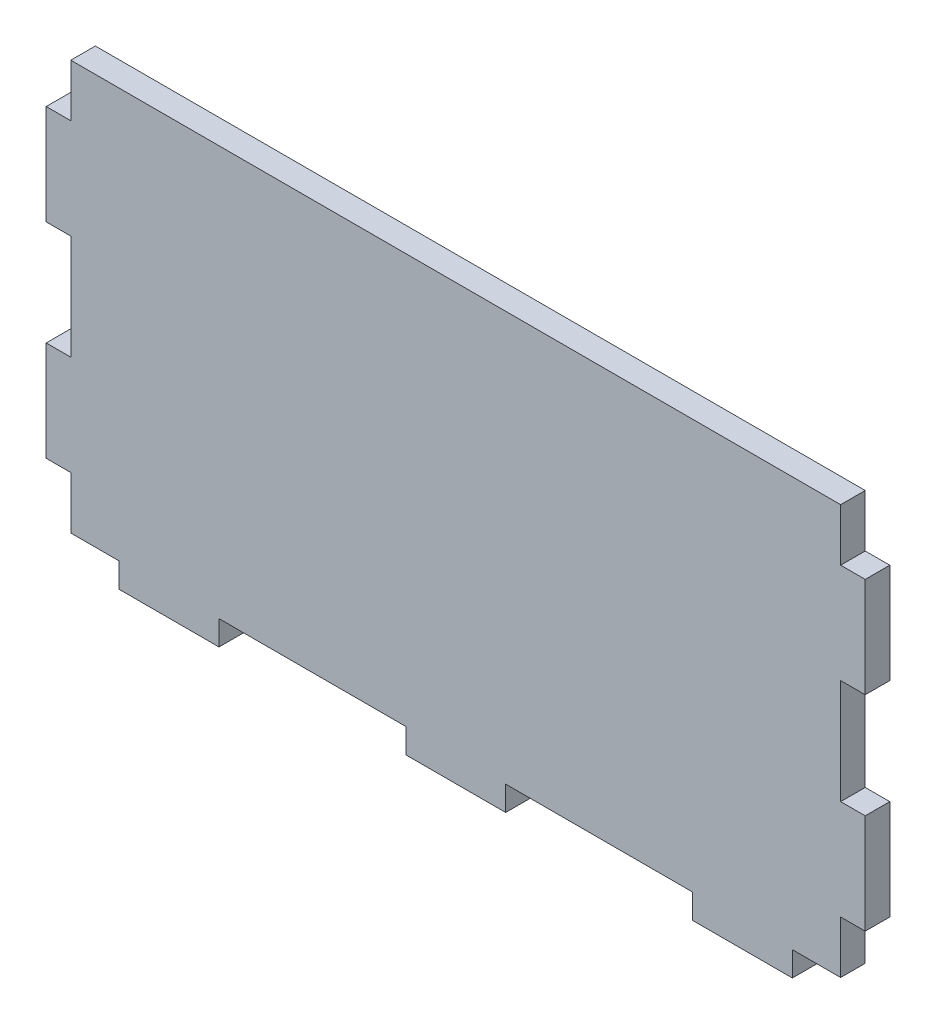
from build123d import *

# Parameters (mm, degrees)
EXTRUDE_1_DEPTH = 3


with BuildPart() as part:
    # Эскиз1 → Бобышка-Вытянуть1 (new body)
    with BuildSketch(Plane.XY):
        Polygon((0, 0), (5.9, 0), (5.9, -3), (18.1, -3), (18.1, 0), (40.9, 0), (40.9, -3), (53.1, -3), (53.1, 0), (75.9, 0), (75.9, -3), (88.1, -3), (88.1, 0), (94, 0), (94, 6.4), (97, 6.4), (97, 18.6), (94, 18.6), (94, 31.4), (97, 31.4), (97, 43.6), (94, 43.6), (94, 50), (0, 50), (0, 43.6), (-3, 43.6), (-3, 31.4), (0, 31.4), (0, 18.6), (-3, 18.6), (-3, 6.4), (0, 6.4), align=None)
    extrude(amount=-EXTRUDE_1_DEPTH)


solid = part.part
